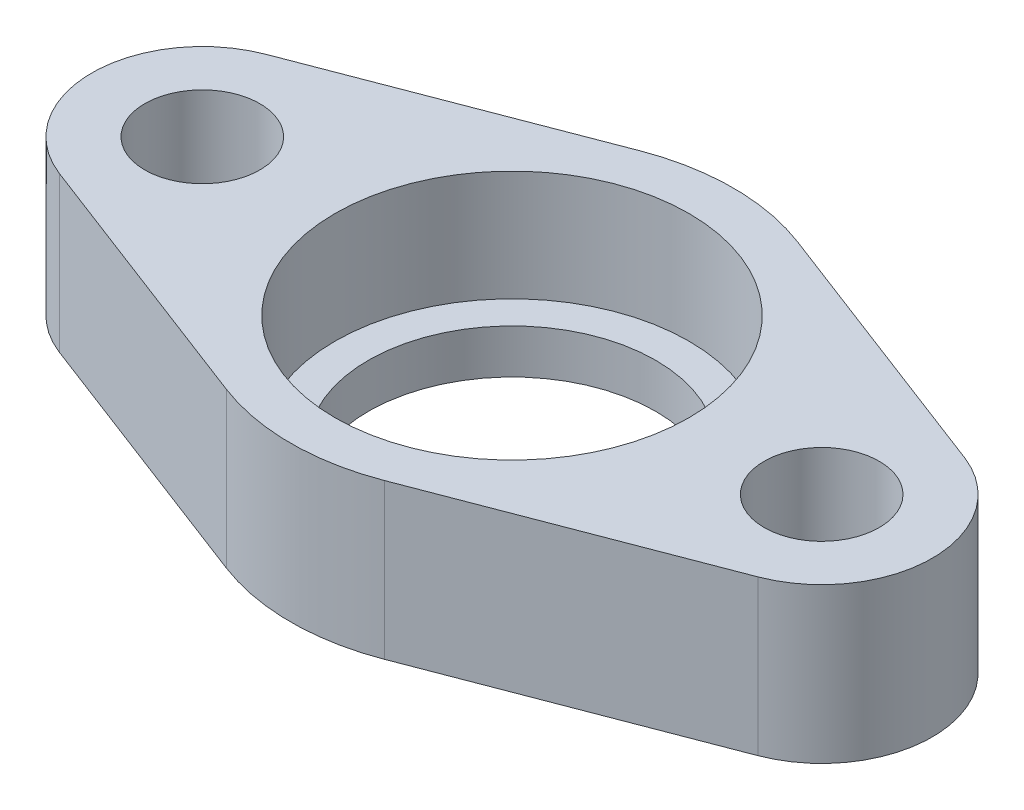
from build123d import *

# Parameters (mm, degrees)
SKETCH1_R            = 5
SKETCH1_R_2          = 4
BOSS_EXTRUDE1_DEPTH  = 3.5
BOSS_EXTRUDE2_DEPTH  = 3.5
M2_CLEARANCE_HOLE1_D = 2.6
SKETCH6_R            = 4
SKETCH6_R_2          = 3.25
BOSS_EXTRUDE4_DEPTH  = 1


with BuildPart() as part:
    # Sketch1 → Boss-Extrude1 (new body)
    with BuildSketch(Plane(origin=(0, 0, 0), x_dir=(1, 0, 0), z_dir=(0, 1, 0))):
        with Locations(Location((0, 0, 0), (0, 0, 270))):
            Circle(SKETCH1_R)
        with Locations(Location((0, 0, 0), (0, 0, 270))):
            Circle(SKETCH1_R_2, mode=Mode.SUBTRACT)
    extrude(amount=BOSS_EXTRUDE1_DEPTH)

    # Sketch2 → Boss-Extrude2 (add)
    with BuildSketch(Plane(origin=(0, 0, 0), x_dir=(1, 0, 0), z_dir=(0, 1, 0))):
        with BuildLine():
            Line((-7.892857143, 2.335124434), (-1.785714286, 4.670248868))
            ThreePointArc((-1.785714286, 4.670248868), (-5, 0), (-1.785714286, -4.670248868))
            Line((-1.785714286, -4.670248868), (-7.892857143, -2.335124434))
            ThreePointArc((-7.892857143, -2.335124434), (-9.5, 0), (-7.892857143, 2.335124434))
        make_face()
        with BuildLine():
            Line((7.892857143, -2.335124434), (1.785714286, -4.670248868))
            ThreePointArc((1.785714286, -4.670248868), (5, 0), (1.785714286, 4.670248868))
            Line((1.785714286, 4.670248868), (7.892857143, 2.335124434))
            ThreePointArc((7.892857143, 2.335124434), (9.5, 0), (7.892857143, -2.335124434))
        make_face()
    extrude(amount=BOSS_EXTRUDE2_DEPTH)

    # M2 Clearance Hole1 (through all)
    with Locations(Plane(origin=(0, 3.5, 0), x_dir=(1, 0, 0), z_dir=(0, 1, 0))):
        with Locations((-7, 0), (7, 0)):
            Hole(M2_CLEARANCE_HOLE1_D / 2)

    # Sketch6 → Boss-Extrude4 (add)
    with BuildSketch(Plane.XZ):
        with Locations(Location((0, 0, 0), (0, 0, 270))):
            Circle(SKETCH6_R)
        with Locations(Location((0, 0, 0), (0, 0, 270))):
            Circle(SKETCH6_R_2, mode=Mode.SUBTRACT)
    extrude(amount=-BOSS_EXTRUDE4_DEPTH)


solid = part.part
